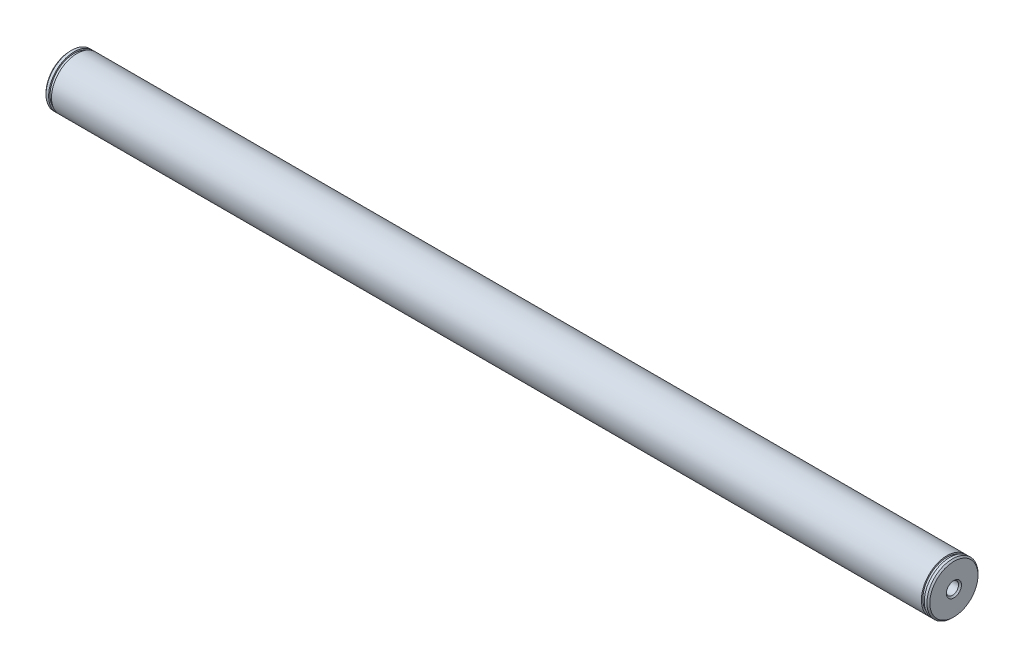
from build123d import *

# Parameters (mm, degrees)
SKETCH1_R           = 11.176
BOSS_EXTRUDE1_DEPTH = 193.3575
CUT_EXTRUDE1_START  = -1.778
SKETCH2_OUTSIDE_W   = 101.952
SKETCH2_OUTSIDE_H   = 101.952
SKETCH2_OUTSIDE_R   = 10.541
CUT_EXTRUDE1_DEPTH  = 1.27
SKETCH3_R           = 2.667
CUT_EXTRUDE2_DEPTH  = 25.4
CHAMFER1_SIZE       = 0.635


with BuildPart() as part:
    # Sketch1 → Boss-Extrude1 (new, symmetric)
    with BuildSketch(Plane(origin=(0, 0, 0), x_dir=(0, 0, -1), z_dir=(1, 0, 0))):
        Circle(SKETCH1_R)
    extrude(amount=BOSS_EXTRUDE1_DEPTH, both=True)

    # Sketch2 outside → Cut-Extrude1 (cut)
    with BuildSketch(Plane.ZY.offset(193.3575).offset(CUT_EXTRUDE1_START)):
        Rectangle(SKETCH2_OUTSIDE_W, SKETCH2_OUTSIDE_H)
        Circle(SKETCH2_OUTSIDE_R, mode=Mode.SUBTRACT)
    cut_extrude1 = extrude(amount=-CUT_EXTRUDE1_DEPTH, mode=Mode.SUBTRACT)

    # Sketch3 → Cut-Extrude2 (cut)
    with BuildSketch(Plane.ZY.offset(193.3575)):
        Circle(SKETCH3_R)
    cut_extrude2 = extrude(amount=-CUT_EXTRUDE2_DEPTH, mode=Mode.SUBTRACT)

    # Mirror1: Cut-Extrude1, Cut-Extrude2 across plane
    add(cut_extrude1.mirror(Plane(origin=(0, 0, 0), x_dir=(0, 0, 1), z_dir=(1, 0, 0))), mode=Mode.SUBTRACT)
    add(cut_extrude2.mirror(Plane(origin=(0, 0, 0), x_dir=(0, 0, 1), z_dir=(1, 0, 0))), mode=Mode.SUBTRACT)

    # Chamfer1
    chamfer1_edges = [part.edges().sort_by_distance(p)[0] for p in [
        (-193.3575, 0, 11.176),
        (-193.3575, 0, -2.667),
        (193.3575, 0, 11.176),
        (193.3575, 0, -2.667),
    ]]
    chamfer(chamfer1_edges, length=CHAMFER1_SIZE)


solid = part.part
